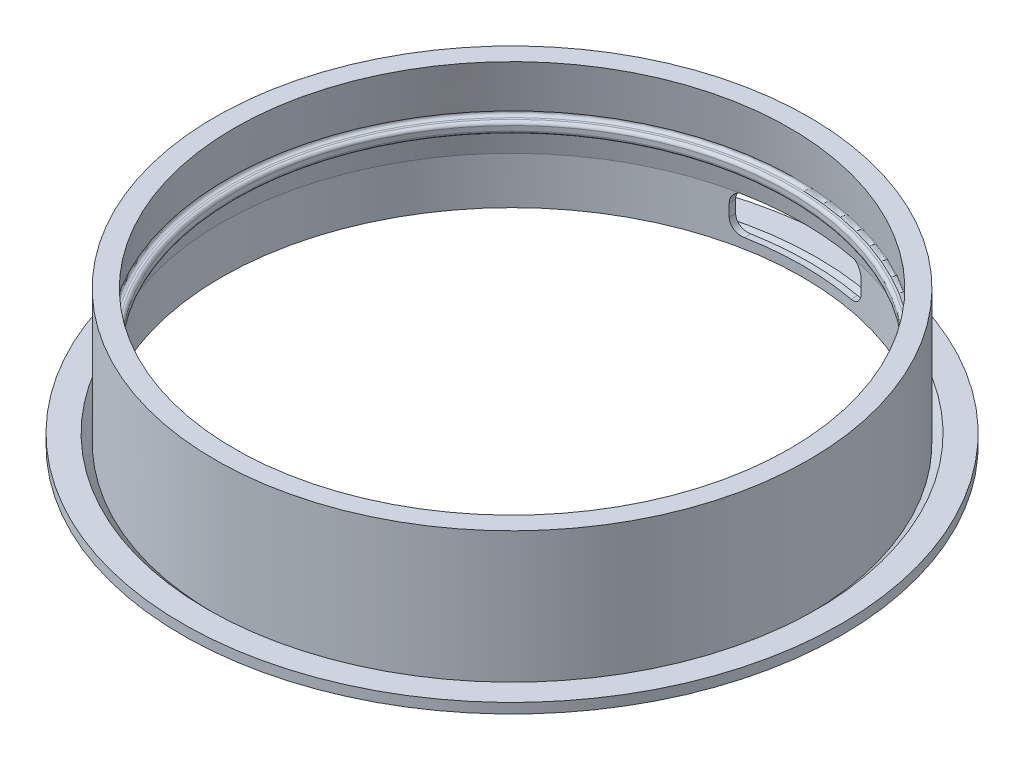
from build123d import *

# Parameters (mm, degrees)
CUT_EXTRUDE1_REACH      = 79.324
CUT_EXTRUDE1_END_RADIUS = 47.3
SKETCH4_W               = 21
SKETCH4_H               = 6
FILLET1_R               = 2
FILLET2_R               = 0.5


with BuildPart() as part:
    # Sketch2 → Revolve1 (revolve)
    with BuildSketch(Plane.XY):
        Polygon((46.3, 0), (46.3, 21.6), (47.3, 21.6), (47.3, 1.6), (52.5, 1.6), (52.5, 0), align=None)
    revolve(axis=Axis((0, -1000, 0), (0, 1, 0)))

    # Cut-Extrude1: up to this cylinder (the profile starts inside it)
    cut_extrude1_end = Plane(origin=(0, 4.6, 0), z_dir=(0, -1, 0)) * Cylinder(CUT_EXTRUDE1_END_RADIUS, 254.248, mode=Mode.PRIVATE)
    # Sketch4 → Cut-Extrude1 (cut, up to the surface)
    with BuildSketch(Plane.XY, mode=Mode.PRIVATE) as cut_extrude1_sk1:
        with Locations((0, 4.6)):
            Rectangle(SKETCH4_W, SKETCH4_H)
    cut_extrude1_tool1 = extrude(cut_extrude1_sk1.sketch, amount=-CUT_EXTRUDE1_REACH, mode=Mode.PRIVATE) & cut_extrude1_end
    add(cut_extrude1_tool1.solids().sort_by_distance((0, 4.6, 0))[0], mode=Mode.SUBTRACT)

    # Fillet1
    fillet1_edges = [part.edges().sort_by_distance(p)[0] for p in [
        (10.5, 1.6, -45.606762076),
        (-10.5, 7.6, -45.606762076),
        (10.5, 7.6, -45.606762076),
        (-10.5, 1.6, -45.606762076),
    ]]
    fillet(fillet1_edges, radius=FILLET1_R)

    # Sketch6 → Revolve2 (revolve)
    with BuildSketch(Plane.XY, mode=Mode.PRIVATE) as revolve2_sk:
        Polygon((-46.3, 7.5), (-44.243032454, 21.6), (-46.3, 21.6), align=None)
        Polygon((-45.431988872, 13.45), (-45.687286263, 11.7), (-44, 11.7), (-44, 13.45), align=None)
    revolve(revolve2_sk.sketch.rotate(Axis((0, -1000, 0), (0, 1, 0)), 180), axis=Axis((0, -1000, 0), (0, 1, 0)))

    # Fillet2
    fillet2_edges = [part.edges().sort_by_distance(p)[0] for p in [
        (-45.687286263, 11.7, 0),
        (-44, 11.7, 0),
        (-44, 13.45, 0),
        (-45.431988872, 13.45, 0),
    ]]
    fillet(fillet2_edges, radius=FILLET2_R)

    # Sketch7 → Cut-Revolve1 (revolve, cut)
    with BuildSketch(Plane.XY):
        Polygon((-47.3, 1.6), (-47.3, 0.35), (-48.55, 1.6), align=None)
    revolve(axis=Axis((0, 0, 0), (0, 1, 0)), mode=Mode.SUBTRACT)


solid = part.part
